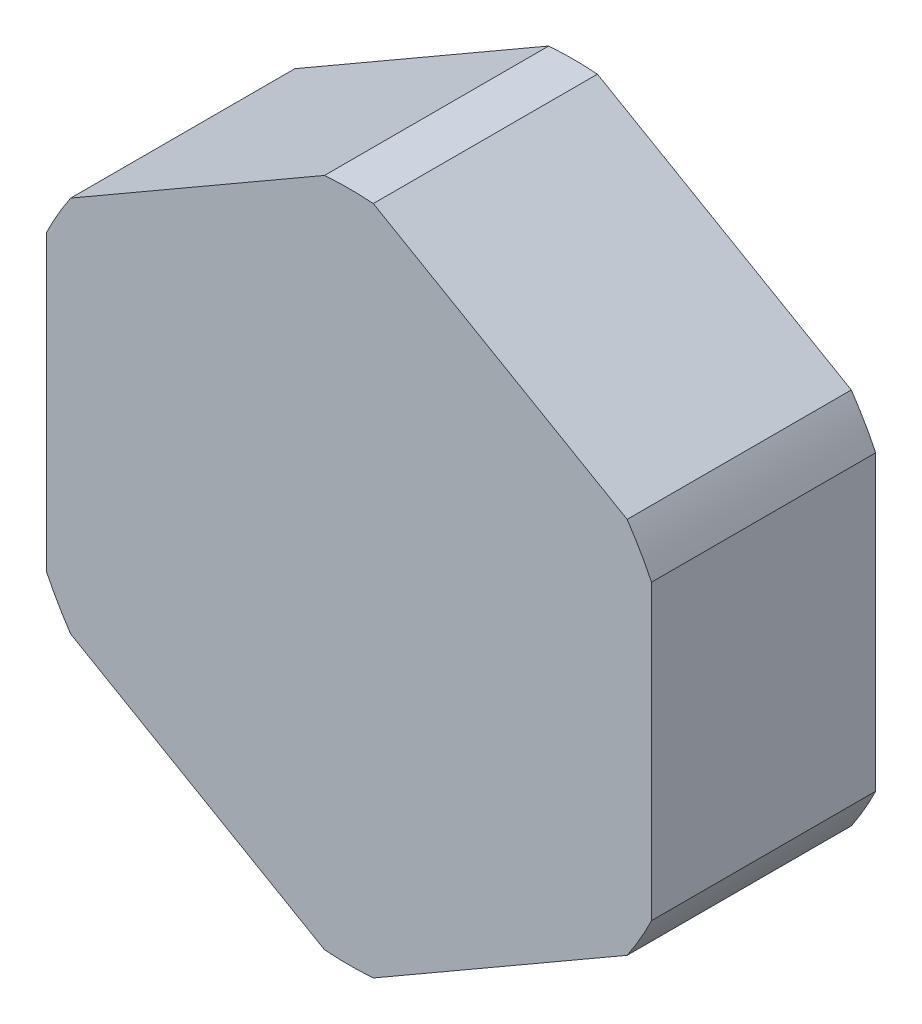
from build123d import *

# Parameters (mm, degrees)
EXTRUDE_1_DEPTH = 10


with BuildPart() as part:
    # Эскиз1 → Бобышка-Вытянуть1 (new body)
    with BuildSketch(Plane.XY):
        with BuildLine():
            ThreePointArc((1.087624174, 14.960517159), (0, 15), (-1.087624174, 14.960517159))
            Line((-1.087624174, 14.960517159), (-12.412375826, 8.422168743))
            ThreePointArc((-12.412375826, 8.422168743), (-12.990381057, 7.5), (-13.5, 6.538348415))
            Line((-13.5, 6.538348415), (-13.5, -6.538348415))
            ThreePointArc((-13.5, -6.538348415), (-12.990381057, -7.5), (-12.412375826, -8.422168743))
            Line((-12.412375826, -8.422168743), (-1.087624174, -14.960517159))
            ThreePointArc((-1.087624174, -14.960517159), (0, -15), (1.087624174, -14.960517159))
            Line((1.087624174, -14.960517159), (12.412375826, -8.422168743))
            ThreePointArc((12.412375826, -8.422168743), (12.990381057, -7.5), (13.5, -6.538348415))
            Line((13.5, -6.538348415), (13.5, 6.538348415))
            ThreePointArc((13.5, 6.538348415), (12.990381057, 7.5), (12.412375826, 8.422168743))
            Line((12.412375826, 8.422168743), (1.087624174, 14.960517159))
        make_face()
    extrude(amount=EXTRUDE_1_DEPTH)


solid = part.part
